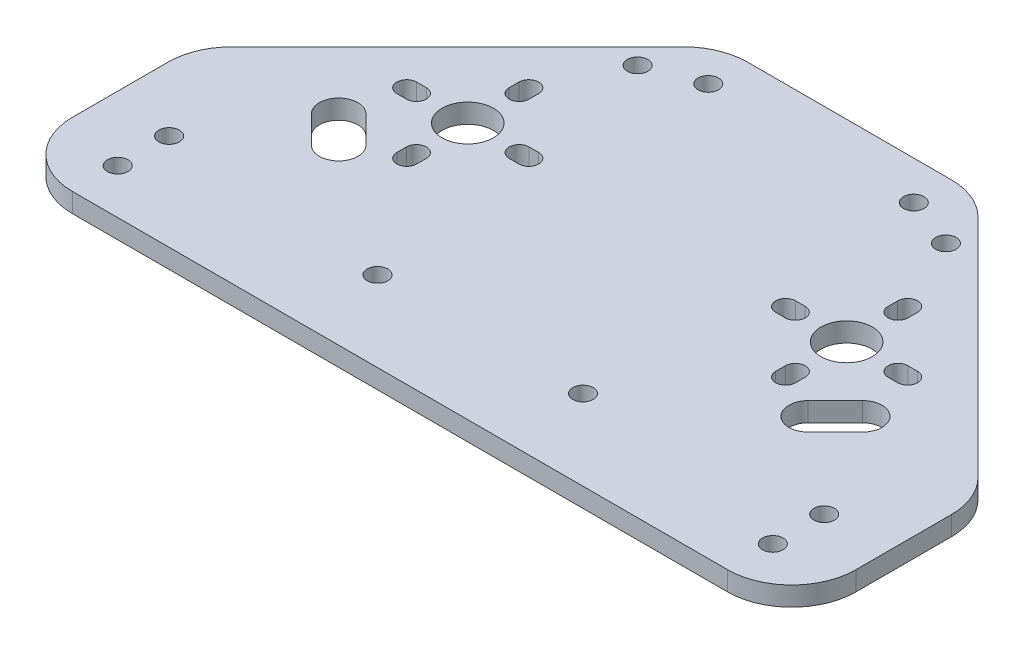
from build123d import *

# Parameters (mm, degrees)
EXTRUDE_1_DEPTH     = 3
SKETCH_2_R          = 1.6
SKETCH_2_R_2        = 4
CUT_EXTRUDE_1_DEPTH = 3


with BuildPart() as part:
    # 草图1 → 凸台-拉伸1 (new body)
    with BuildSketch(Plane(origin=(0, 0, 0), x_dir=(1, 0, 0), z_dir=(0, 1, 0))):
        with BuildLine():
            Line((0, 30), (-15.857864376, 30))
            ThreePointArc((-15.857864376, 30), (-19.6846987, 29.238795325), (-22.928932188, 27.071067812))
            Line((-22.928932188, 27.071067812), (-58.071067812, -8.071067812))
            ThreePointArc((-58.071067812, -8.071067812), (-60.238795325, -11.3153013), (-61, -15.142135624))
            Line((-61, -15.142135624), (-61, -30.000000004))
            ThreePointArc((-61, -30.000000004), (-58.071067812, -37.071067816), (-51, -40.000000004))
            Line((-51, -40.000000004), (-36, -40.000000004))
            Line((-36, -40.000000004), (36, -40.000000004))
            Line((36, -40.000000004), (51, -40.000000004))
            ThreePointArc((51, -40.000000004), (58.071067812, -37.071067816), (61, -30.000000004))
            Line((61, -30.000000004), (61, -15.142135624))
            ThreePointArc((61, -15.142135624), (60.238795325, -11.3153013), (58.071067812, -8.071067812))
            Line((58.071067812, -8.071067812), (22.928932188, 27.071067812))
            ThreePointArc((22.928932188, 27.071067812), (19.6846987, 29.238795325), (15.857864376, 30))
            Line((15.857864376, 30), (0, 30))
        make_face()
    extrude(amount=EXTRUDE_1_DEPTH)

    # 草图2 → 切除-拉伸1 (cut)
    with BuildSketch(Plane(origin=(0, 0, 0), x_dir=(1, 0, 0), z_dir=(0, 1, 0))):
        with Locations(Location((-16, 24, 0), (0, 0, 270))):
            Circle(SKETCH_2_R)
        with Locations(Location((16, 24, 0), (0, 0, 270))):
            Circle(SKETCH_2_R)
        with Locations(Location((-24, 21, 0), (0, 0, 270))):
            Circle(SKETCH_2_R)
        with Locations(Location((24, 21, 0), (0, 0, 270))):
            Circle(SKETCH_2_R)
        with Locations(Location((-29.450477816, 0, 0), (0, 0, 270))):
            Circle(SKETCH_2_R_2)
        with Locations(Location((29.549522184, 0, 0), (0, 0, 90))):
            Circle(SKETCH_2_R_2)
        with Locations(Location((-50.950477816, -25, 0), (0, 0, 270))):
            Circle(SKETCH_2_R)
        with Locations(Location((-50.950477816, -33, 0), (0, 0, 270))):
            Circle(SKETCH_2_R)
        with Locations(Location((51.049522184, -33, 0), (0, 0, 90))):
            Circle(SKETCH_2_R)
        with Locations(Location((51.049522184, -25, 0), (0, 0, 90))):
            Circle(SKETCH_2_R)
        with Locations(Location((-16, -27.5, 0), (0, 0, 270))):
            Circle(SKETCH_2_R)
        with Locations(Location((16, -27.5, 0), (0, 0, 270))):
            Circle(SKETCH_2_R)
        with BuildLine():
            Line((-37.450477816, -1.55), (-38.950477816, -1.55))
            ThreePointArc((-38.950477816, -1.55), (-40.500477816, 0), (-38.950477816, 1.55))
            Line((-38.950477816, 1.55), (-37.450477816, 1.55))
            ThreePointArc((-37.450477816, 1.55), (-35.900477816, 0), (-37.450477816, -1.55))
        make_face()
        with BuildLine():
            Line((38.728201841, -6.678679656), (34.485561154, -10.921320344))
            ThreePointArc((34.485561154, -10.921320344), (34.485561154, -15.163961031), (38.728201841, -15.163961031))
            Line((38.728201841, -15.163961031), (42.970842528, -10.921320344))
            ThreePointArc((42.970842528, -10.921320344), (42.970842528, -6.678679656), (38.728201841, -6.678679656))
        make_face()
        with BuildLine():
            Line((-31.000477816, 8), (-31.000477816, 9.5))
            ThreePointArc((-31.000477816, 9.5), (-29.450315952, 11.050161864), (-27.900154088, 9.5))
            Line((-27.900154088, 9.5), (-27.900154088, 8))
            ThreePointArc((-27.900154088, 8), (-29.450315952, 6.449838136), (-31.000477816, 8))
        make_face()
        with BuildLine():
            Line((-27.900477816, -8), (-27.900477816, -9.5))
            ThreePointArc((-27.900477816, -9.5), (-29.450477816, -11.05), (-31.000477816, -9.5))
            Line((-31.000477816, -9.5), (-31.000477816, -8))
            ThreePointArc((-31.000477816, -8), (-29.450477816, -6.45), (-27.900477816, -8))
        make_face()
        with BuildLine():
            Line((-21.450477816, 1.55), (-19.950477816, 1.55))
            ThreePointArc((-19.950477816, 1.55), (-18.400477816, 0), (-19.950477816, -1.55))
            Line((-19.950477816, -1.55), (-21.450477816, -1.55))
            ThreePointArc((-21.450477816, -1.55), (-23.000477816, 0), (-21.450477816, 1.55))
        make_face()
        with BuildLine():
            Line((21.549522184, -1.55), (20.049522184, -1.55))
            ThreePointArc((20.049522184, -1.55), (18.499522184, 0), (20.049522184, 1.55))
            Line((20.049522184, 1.55), (21.549522184, 1.55))
            ThreePointArc((21.549522184, 1.55), (23.099522184, 0), (21.549522184, -1.55))
        make_face()
        with BuildLine():
            Line((-42.871798159, -10.921320344), (-38.629157472, -15.163961031))
            ThreePointArc((-38.629157472, -15.163961031), (-34.386516785, -15.163961031), (-34.386516785, -10.921320344))
            Line((-34.386516785, -10.921320344), (-38.629157472, -6.678679656))
            ThreePointArc((-38.629157472, -6.678679656), (-42.871798159, -6.678679656), (-42.871798159, -10.921320344))
        make_face()
        with BuildLine():
            Line((31.099522184, -8), (31.099522184, -9.5))
            ThreePointArc((31.099522184, -9.5), (29.549522184, -11.05), (27.999522184, -9.5))
            Line((27.999522184, -9.5), (27.999522184, -8))
            ThreePointArc((27.999522184, -8), (29.549522184, -6.45), (31.099522184, -8))
        make_face()
        with BuildLine():
            Line((27.999522184, 8), (27.999522184, 9.5))
            ThreePointArc((27.999522184, 9.5), (29.549522184, 11.05), (31.099522184, 9.5))
            Line((31.099522184, 9.5), (31.099522184, 8))
            ThreePointArc((31.099522184, 8), (29.549522184, 6.45), (27.999522184, 8))
        make_face()
        with BuildLine():
            Line((37.549522184, 1.55), (39.049522184, 1.55))
            ThreePointArc((39.049522184, 1.55), (40.599522184, 0), (39.049522184, -1.55))
            Line((39.049522184, -1.55), (37.549522184, -1.55))
            ThreePointArc((37.549522184, -1.55), (35.999522184, 0), (37.549522184, 1.55))
        make_face()
    extrude(amount=CUT_EXTRUDE_1_DEPTH, mode=Mode.SUBTRACT)


solid = part.part
